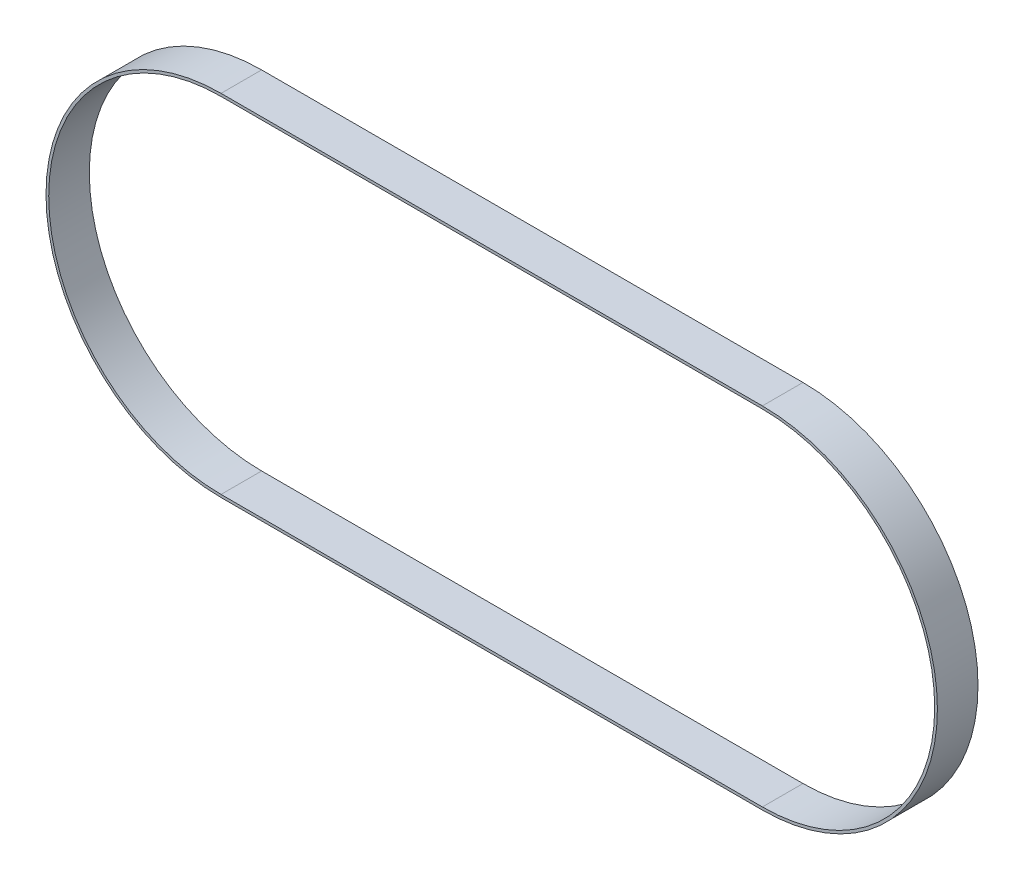
from build123d import *

# Parameters (mm, degrees)
BOSS_EXTRUDE1_DEPTH = 15


with BuildPart() as part:
    # Sketch1 → Boss-Extrude1 (new body)
    with BuildSketch(Plane.XY):
        with BuildLine():
            Line((-100, 64.661977237), (100, 64.661977237))
            ThreePointArc((100, 64.661977237), (164.661977237, 0), (100, -64.661977237))
            Line((100, -64.661977237), (-100, -64.661977237))
            ThreePointArc((-100, -64.661977237), (-164.661977237, 0), (-100, 64.661977237))
        make_face()
        with BuildLine():
            Line((-100, 63.661977237), (100, 63.661977237))
            ThreePointArc((100, 63.661977237), (163.661977237, 0), (100, -63.661977237))
            Line((100, -63.661977237), (-100, -63.661977237))
            ThreePointArc((-100, -63.661977237), (-163.661977237, 0), (-100, 63.661977237))
        make_face(mode=Mode.SUBTRACT)
    extrude(amount=BOSS_EXTRUDE1_DEPTH)


solid = part.part
